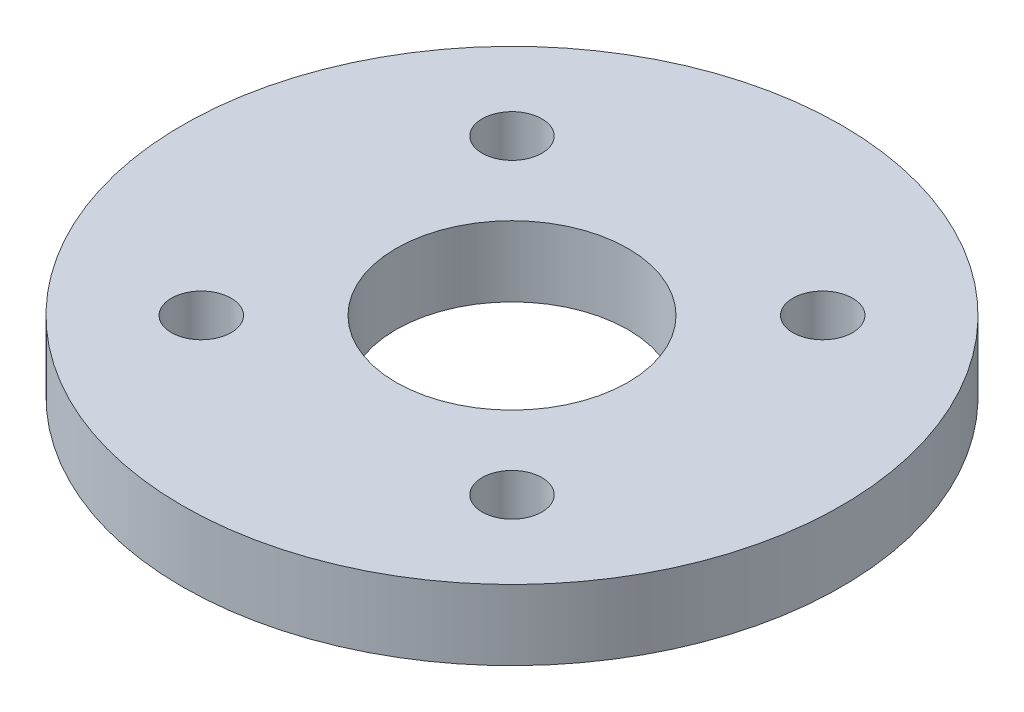
from build123d import *

# Parameters (mm, degrees)
SKETCH1_R           = 18.75
SKETCH1_R_2         = 1.7
SKETCH1_R_3         = 6.6
BOSS_EXTRUDE1_DEPTH = 4


with BuildPart() as part:
    # Sketch1 → Boss-Extrude1 (new body)
    with BuildSketch(Plane(origin=(0, 0, 0), x_dir=(1, 0, 0), z_dir=(0, 1, 0))):
        with Locations(Location((0, 0, 0), (0, 0, 270))):
            Circle(SKETCH1_R)
        with Locations(Location((-8.838834765, 8.838834765, 0), (0, 0, 270))):
            Circle(SKETCH1_R_2, mode=Mode.SUBTRACT)
        with Locations(Location((-8.838834765, -8.838834765, 0), (0, 0, 270))):
            Circle(SKETCH1_R_2, mode=Mode.SUBTRACT)
        with Locations(Location((8.838834765, -8.838834765, 0), (0, 0, 270))):
            Circle(SKETCH1_R_2, mode=Mode.SUBTRACT)
        with Locations(Location((8.838834765, 8.838834765, 0), (0, 0, 270))):
            Circle(SKETCH1_R_2, mode=Mode.SUBTRACT)
        with Locations(Location((0, 0, 0), (0, 0, 270))):
            Circle(SKETCH1_R_3, mode=Mode.SUBTRACT)
    extrude(amount=BOSS_EXTRUDE1_DEPTH)


solid = part.part
